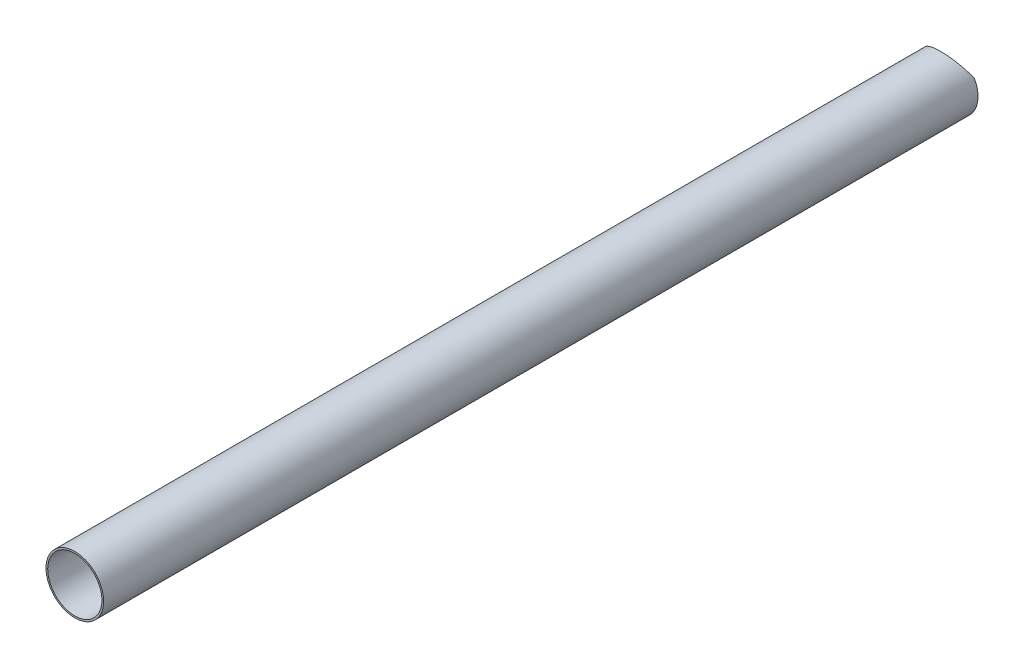
from build123d import *

# Parameters (mm, degrees)
SKETCH1_W               = 819.15
SKETCH1_H               = 1.5875
CUT_EXTRUDE1_DEPTH      = 821.038641048
CUT_EXTRUDE1_DEPTH_BACK = 821.038641048


with BuildPart() as part:
    # Sketch1 → Revolve1 (revolve)
    with BuildSketch(Plane(origin=(0, 0, 0), x_dir=(0, 0, -1), z_dir=(1, 0, 0)), mode=Mode.PRIVATE) as revolve1_sk:
        with Locations((409.575, 26.19375)):
            Rectangle(SKETCH1_W, SKETCH1_H)
    revolve(revolve1_sk.sketch.rotate(Axis((0, 0, 0), (0, 0, 1)), 90), axis=Axis((0, 0, 0), (0, 0, 1)))

    # Sketch2 → Cut-Extrude1 (cut, two sides: drawn at the far end of the back side and taken through both)
    with BuildSketch(Plane(origin=(0, 0, 0), x_dir=(0, 0, -1), z_dir=(1, 0, 0)).offset(-CUT_EXTRUDE1_DEPTH_BACK)):
        Polygon((819.15, 13.239346715), (811.2125, 26.9875), (819.15, 26.9875), align=None)
    extrude(amount=CUT_EXTRUDE1_DEPTH + CUT_EXTRUDE1_DEPTH_BACK, mode=Mode.SUBTRACT)


solid = part.part
